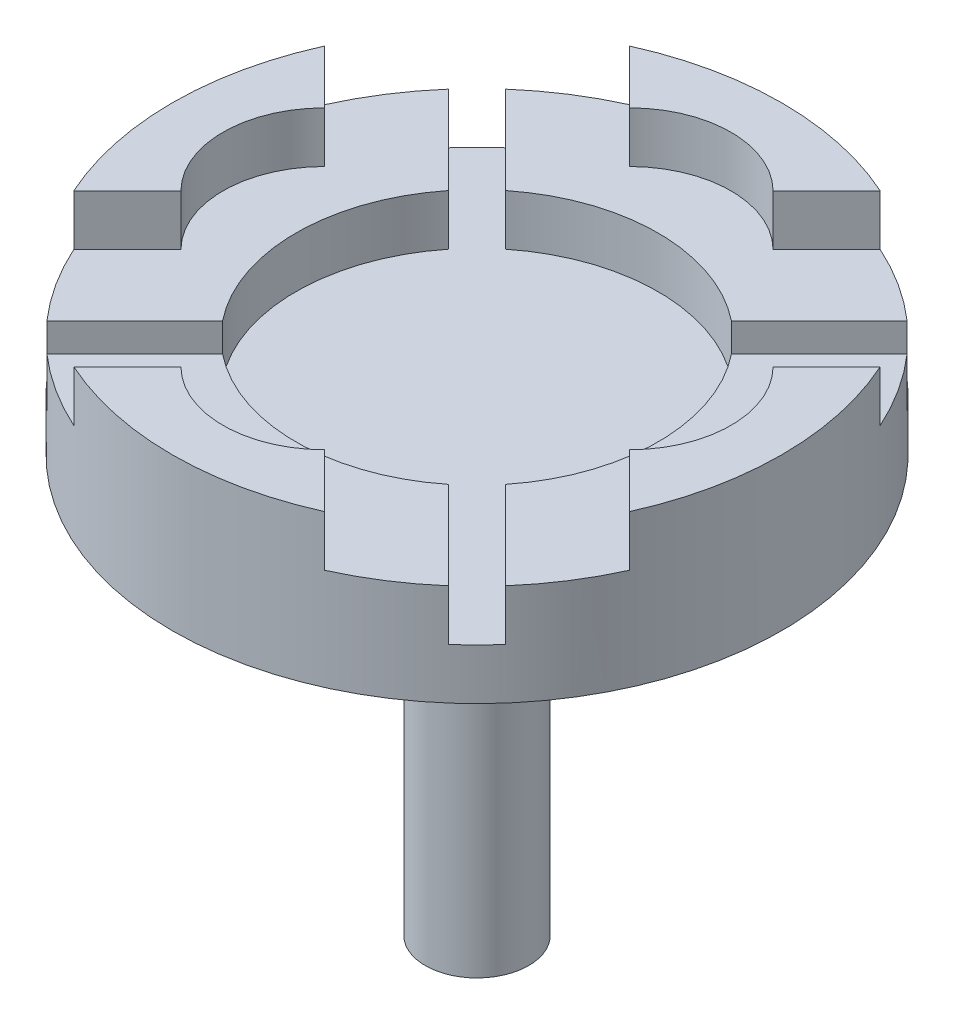
from build123d import *

# Parameters (mm, degrees)
SKETCH_1_R          = 150
EXTRUDE_1_DEPTH     = 50
CUT_EXTRUDE_START   = -25
CUT_EXTRUDE_1_DEPTH = 25
EXTRUDE_2_DEPTH     = 25
SKETCH_4_R          = 10
EXTRUDE_3_DEPTH     = 30
SKETCH_5_R          = 25.46
EXTRUDE_4_DEPTH     = 175
SKETCH_6_R          = 10
EXTRUDE_5_DEPTH     = 10


with BuildPart() as part:
    # 草图1 → 凸台-拉伸1 (new body)
    with BuildSketch(Plane(origin=(0, 0, 0), x_dir=(1, 0, 0), z_dir=(0, 1, 0))):
        with Locations(Location((0, 0, 0), (0, 0, 270))):
            Circle(SKETCH_1_R)
    extrude(amount=EXTRUDE_1_DEPTH)

    # 草图2 → 切除-拉伸1 (cut)
    with BuildSketch(Plane(origin=(0, 50, 0), x_dir=(1, 0, 0), z_dir=(0, 1, 0)).offset(CUT_EXTRUDE_START)):
        with BuildLine():
            Line((106.066017178, -106.066017178), (63.003214204, -63.003214204))
            ThreePointArc((63.003214204, -63.003214204), (59.362488155, -66.444751486), (55.534083733, -69.676219357))
            Line((55.534083733, -69.676219357), (98.758984631, -112.901120254))
            ThreePointArc((98.758984631, -112.901120254), (102.46950766, -109.544511501), (106.066017178, -106.066017178))
        make_face()
        with BuildLine():
            ThreePointArc((69.676219357, -55.534083733), (66.444751486, -59.362488155), (63.003214204, -63.003214204))
            Line((63.003214204, -63.003214204), (106.066017178, -106.066017178))
            ThreePointArc((106.066017178, -106.066017178), (109.544511501, -102.46950766), (112.901120254, -98.758984631))
            Line((112.901120254, -98.758984631), (69.676219357, -55.534083733))
        make_face()
        with BuildLine():
            Line((14.142135624, 0), (7.071067812, -7.071067812))
            Line((7.071067812, -7.071067812), (63.003214204, -63.003214204))
            ThreePointArc((63.003214204, -63.003214204), (66.444751486, -59.362488155), (69.676219357, -55.534083733))
            Line((69.676219357, -55.534083733), (14.142135624, 0))
        make_face()
        with BuildLine():
            Line((63.003214204, -63.003214204), (7.071067812, -7.071067812))
            Line((7.071067812, -7.071067812), (0, -14.142135624))
            Line((0, -14.142135624), (55.534083733, -69.676219357))
            ThreePointArc((55.534083733, -69.676219357), (59.362488155, -66.444751486), (63.003214204, -63.003214204))
        make_face()
        with BuildLine():
            Line((55.534083733, -69.676219357), (0, -14.142135624))
            Line((0, -14.142135624), (-55.534083733, -69.676219357))
            ThreePointArc((-55.534083733, -69.676219357), (0, -89.1), (55.534083733, -69.676219357))
        make_face()
        with BuildLine():
            Line((0, -14.142135624), (-7.071067812, -7.071067812))
            Line((-7.071067812, -7.071067812), (-63.003214204, -63.003214204))
            ThreePointArc((-63.003214204, -63.003214204), (-59.362488155, -66.444751486), (-55.534083733, -69.676219357))
            Line((-55.534083733, -69.676219357), (0, -14.142135624))
        make_face()
        with BuildLine():
            Line((-63.003214204, -63.003214204), (-7.071067812, -7.071067812))
            Line((-7.071067812, -7.071067812), (-14.142135624, 0))
            Line((-14.142135624, 0), (-69.676219357, -55.534083733))
            ThreePointArc((-69.676219357, -55.534083733), (-66.444751486, -59.362488155), (-63.003214204, -63.003214204))
        make_face()
        with BuildLine():
            Line((106.066017178, 106.066017178), (63.003214204, 63.003214204))
            ThreePointArc((63.003214204, 63.003214204), (66.444751486, 59.362488155), (69.676219357, 55.534083733))
            Line((69.676219357, 55.534083733), (112.901120254, 98.758984631))
            ThreePointArc((112.901120254, 98.758984631), (109.544511501, 102.46950766), (106.066017178, 106.066017178))
        make_face()
        with BuildLine():
            ThreePointArc((-55.534083733, -69.676219357), (-59.362488155, -66.444751486), (-63.003214204, -63.003214204))
            Line((-63.003214204, -63.003214204), (-106.066017178, -106.066017178))
            ThreePointArc((-106.066017178, -106.066017178), (-102.46950766, -109.544511501), (-98.758984631, -112.901120254))
            Line((-98.758984631, -112.901120254), (-55.534083733, -69.676219357))
        make_face()
        with BuildLine():
            ThreePointArc((55.534083733, 69.676219357), (59.362488155, 66.444751486), (63.003214204, 63.003214204))
            Line((63.003214204, 63.003214204), (106.066017178, 106.066017178))
            ThreePointArc((106.066017178, 106.066017178), (102.46950766, 109.544511501), (98.758984631, 112.901120254))
            Line((98.758984631, 112.901120254), (55.534083733, 69.676219357))
        make_face()
        with BuildLine():
            Line((-106.066017178, -106.066017178), (-63.003214204, -63.003214204))
            ThreePointArc((-63.003214204, -63.003214204), (-66.444751486, -59.362488155), (-69.676219357, -55.534083733))
            Line((-69.676219357, -55.534083733), (-112.901120254, -98.758984631))
            ThreePointArc((-112.901120254, -98.758984631), (-109.544511501, -102.46950766), (-106.066017178, -106.066017178))
        make_face()
        with BuildLine():
            Line((-69.676219357, -55.534083733), (-14.142135624, 0))
            Line((-14.142135624, 0), (-69.676219357, 55.534083733))
            ThreePointArc((-69.676219357, 55.534083733), (-89.1, 0), (-69.676219357, -55.534083733))
        make_face()
        with BuildLine():
            Line((-14.142135624, 0), (-7.071067812, 7.071067812))
            Line((-7.071067812, 7.071067812), (-63.003214204, 63.003214204))
            ThreePointArc((-63.003214204, 63.003214204), (-66.444751486, 59.362488155), (-69.676219357, 55.534083733))
            Line((-69.676219357, 55.534083733), (-14.142135624, 0))
        make_face()
        with BuildLine():
            Line((-63.003214204, 63.003214204), (-7.071067812, 7.071067812))
            Line((-7.071067812, 7.071067812), (0, 14.142135624))
            Line((0, 14.142135624), (-55.534083733, 69.676219357))
            ThreePointArc((-55.534083733, 69.676219357), (-59.362488155, 66.444751486), (-63.003214204, 63.003214204))
        make_face()
        Polygon((7.071067812, -7.071067812), (0, 0), (-7.071067812, -7.071067812), (0, -14.142135624), align=None)
        Polygon((-7.071067812, -7.071067812), (0, 0), (-7.071067812, 7.071067812), (-14.142135624, 0), align=None)
        Polygon((7.071067812, 7.071067812), (0, 0), (14.142135624, 0), align=None)
        Polygon((14.142135624, 0), (0, 0), (7.071067812, -7.071067812), align=None)
        Polygon((-7.071067812, 7.071067812), (0, 0), (7.071067812, 7.071067812), (0, 14.142135624), align=None)
        with BuildLine():
            Line((0, 14.142135624), (7.071067812, 7.071067812))
            Line((7.071067812, 7.071067812), (63.003214204, 63.003214204))
            ThreePointArc((63.003214204, 63.003214204), (59.362488155, 66.444751486), (55.534083733, 69.676219357))
            Line((55.534083733, 69.676219357), (0, 14.142135624))
        make_face()
        with BuildLine():
            Line((63.003214204, 63.003214204), (7.071067812, 7.071067812))
            Line((7.071067812, 7.071067812), (14.142135624, 0))
            Line((14.142135624, 0), (69.676219357, 55.534083733))
            ThreePointArc((69.676219357, 55.534083733), (66.444751486, 59.362488155), (63.003214204, 63.003214204))
        make_face()
        with BuildLine():
            ThreePointArc((-69.676219357, 55.534083733), (-66.444751486, 59.362488155), (-63.003214204, 63.003214204))
            Line((-63.003214204, 63.003214204), (-106.066017178, 106.066017178))
            ThreePointArc((-106.066017178, 106.066017178), (-109.544511501, 102.46950766), (-112.901120254, 98.758984631))
            Line((-112.901120254, 98.758984631), (-69.676219357, 55.534083733))
        make_face()
        with BuildLine():
            Line((-106.066017178, 106.066017178), (-63.003214204, 63.003214204))
            ThreePointArc((-63.003214204, 63.003214204), (-59.362488155, 66.444751486), (-55.534083733, 69.676219357))
            Line((-55.534083733, 69.676219357), (-98.758984631, 112.901120254))
            ThreePointArc((-98.758984631, 112.901120254), (-102.46950766, 109.544511501), (-106.066017178, 106.066017178))
        make_face()
        with BuildLine():
            Line((69.676219357, 55.534083733), (14.142135624, 0))
            Line((14.142135624, 0), (89.1, 0))
            ThreePointArc((89.1, 0), (84.103986662, 29.416482245), (69.676219357, 55.534083733))
        make_face()
        with BuildLine():
            Line((89.1, 0), (14.142135624, 0))
            Line((14.142135624, 0), (69.676219357, -55.534083733))
            ThreePointArc((69.676219357, -55.534083733), (84.103986662, -29.416482245), (89.1, 0))
        make_face()
        with BuildLine():
            Line((-55.534083733, 69.676219357), (0, 14.142135624))
            Line((0, 14.142135624), (55.534083733, 69.676219357))
            ThreePointArc((55.534083733, 69.676219357), (0, 89.1), (-55.534083733, 69.676219357))
        make_face()
    extrude(amount=CUT_EXTRUDE_1_DEPTH, mode=Mode.SUBTRACT)

    # 草图3 → 凸台-拉伸2 (add)
    with BuildSketch(Plane(origin=(0, 50, 0), x_dir=(1, 0, 0), z_dir=(0, 1, 0))):
        with BuildLine():
            Line((-136.715674165, -61.715674165), (-110.355339059, -35.355339059))
            ThreePointArc((-110.355339059, -35.355339059), (-125, 0), (-110.355339059, 35.355339059))
            Line((-110.355339059, 35.355339059), (-136.715674165, 61.715674165))
            ThreePointArc((-136.715674165, 61.715674165), (-150, 0), (-136.715674165, -61.715674165))
        make_face()
        with BuildLine():
            Line((35.355339059, 110.355339059), (61.715674165, 136.715674165))
            ThreePointArc((61.715674165, 136.715674165), (0, 150), (-61.715674165, 136.715674165))
            Line((-61.715674165, 136.715674165), (-35.355339059, 110.355339059))
            ThreePointArc((-35.355339059, 110.355339059), (0, 125), (35.355339059, 110.355339059))
        make_face()
        with BuildLine():
            Line((136.715674165, 61.715674165), (110.355339059, 35.355339059))
            ThreePointArc((110.355339059, 35.355339059), (121.193976626, 19.134171618), (125, 0))
            ThreePointArc((125, 0), (121.193976626, -19.134171618), (110.355339059, -35.355339059))
            Line((110.355339059, -35.355339059), (136.715674165, -61.715674165))
            ThreePointArc((136.715674165, -61.715674165), (146.641316014, -31.564607357), (150, 0))
            ThreePointArc((150, 0), (146.641316014, 31.564607357), (136.715674165, 61.715674165))
        make_face()
        with BuildLine():
            Line((61.715674165, -136.715674165), (35.355339059, -110.355339059))
            ThreePointArc((35.355339059, -110.355339059), (0, -125), (-35.355339059, -110.355339059))
            Line((-35.355339059, -110.355339059), (-61.715674165, -136.715674165))
            ThreePointArc((-61.715674165, -136.715674165), (0, -150), (61.715674165, -136.715674165))
        make_face()
    extrude(amount=EXTRUDE_2_DEPTH)

    # 草图4 → 凸台-拉伸3 (add)
    with BuildSketch(Plane.XZ):
        with Locations(Location((0, 0, 0), (0, 0, 90))):
            Circle(SKETCH_4_R)
    extrude(amount=EXTRUDE_3_DEPTH)

    # 草图5 → 凸台-拉伸4 (add)
    with BuildSketch(Plane.XZ.offset(30)):
        with Locations(Location((0, 0, 0), (0, 0, 270))):
            Circle(SKETCH_5_R)
    extrude(amount=EXTRUDE_4_DEPTH)

    # 草图6 → 凸台-拉伸5 (add)
    with BuildSketch(Plane.XZ.offset(205)):
        with Locations(Location((0, 0, 0), (0, 0, 90))):
            Circle(SKETCH_6_R)
    extrude(amount=EXTRUDE_5_DEPTH)


solid = part.part
